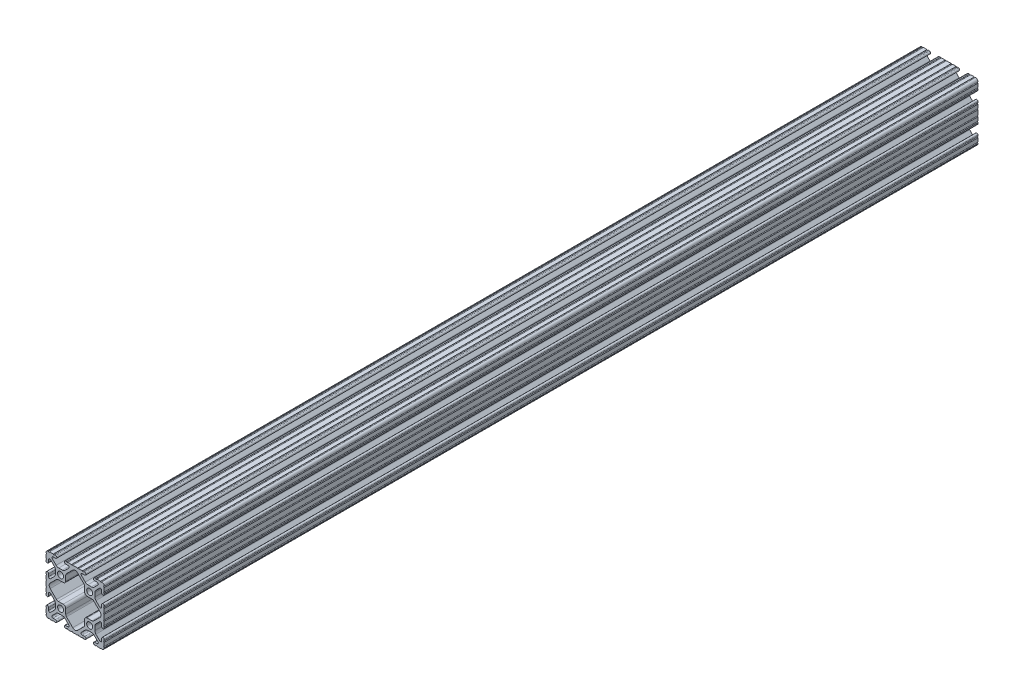
from build123d import *

# Parameters (mm, degrees)
SKETCH1_R      = 2.6035
EXTRUDE1_DEPTH = 381


with BuildPart() as part:
    # Sketch1 → Extrude1 (new, symmetric)
    with BuildSketch(Plane.XY):
        with BuildLine():
            Line((-2.1336, -25.4), (2.1336, -25.4))
            ThreePointArc((2.1336, -25.4), (2.6416, -24.892), (3.1496, -25.4))
            Line((3.1496, -25.4), (6.3754, -25.4))
            ThreePointArc((6.3754, -25.4), (6.8834, -24.892), (7.3914, -25.4))
            Line((7.3914, -25.4), (8.3439, -25.4))
            ThreePointArc((8.3439, -25.4), (9.4488, -24.2951), (8.3439, -23.1902))
            Line((8.3439, -23.1902), (6.225205544, -23.1902))
            ThreePointArc((6.225205544, -23.1902), (5.286543939, -22.563006367), (5.506785055, -21.45577951))
            Line((5.506785055, -21.45577951), (8.824128595, -18.13843597))
            ThreePointArc((8.824128595, -18.13843597), (9.854172728, -17.450182484), (11.069192626, -17.2085))
            Line((11.069192626, -17.2085), (14.330807374, -17.2085))
            ThreePointArc((14.330807374, -17.2085), (15.545827272, -17.450182484), (16.575871405, -18.13843597))
            Line((16.575871405, -18.13843597), (19.893214945, -21.45577951))
            ThreePointArc((19.893214945, -21.45577951), (20.113456061, -22.563006367), (19.174794456, -23.1902))
            Line((19.174794456, -23.1902), (17.0561, -23.1902))
            ThreePointArc((17.0561, -23.1902), (15.9512, -24.2951), (17.0561, -25.4))
            Line((17.0561, -25.4), (18.0086, -25.4))
            ThreePointArc((18.0086, -25.4), (18.5166, -24.892), (19.0246, -25.4))
            Line((19.0246, -25.4), (22.2504, -25.4))
            ThreePointArc((22.2504, -25.4), (22.7584, -24.892), (23.2664, -25.4))
            Line((23.2664, -25.4), (23.2918, -25.4))
            ThreePointArc((23.2918, -25.4), (24.782522516, -24.782522516), (25.4, -23.2918))
            Line((25.4, -23.2918), (25.4, -23.2664))
            ThreePointArc((25.4, -23.2664), (24.892, -22.7584), (25.4, -22.2504))
            Line((25.4, -22.2504), (25.4, -19.0246))
            ThreePointArc((25.4, -19.0246), (24.892, -18.5166), (25.4, -18.0086))
            Line((25.4, -18.0086), (25.4, -17.0561))
            ThreePointArc((25.4, -17.0561), (24.2951, -15.9512), (23.1902, -17.0561))
            Line((23.1902, -17.0561), (23.1902, -19.174794456))
            ThreePointArc((23.1902, -19.174794456), (22.563006367, -20.113456061), (21.45577951, -19.893214945))
            Line((21.45577951, -19.893214945), (18.13843597, -16.575871405))
            ThreePointArc((18.13843597, -16.575871405), (17.450182484, -15.545827272), (17.2085, -14.330807374))
            Line((17.2085, -14.330807374), (17.2085, -11.069192626))
            ThreePointArc((17.2085, -11.069192626), (17.450182484, -9.854172728), (18.13843597, -8.824128595))
            Line((18.13843597, -8.824128595), (21.45577951, -5.506785055))
            ThreePointArc((21.45577951, -5.506785055), (22.563006367, -5.286543939), (23.1902, -6.225205544))
            Line((23.1902, -6.225205544), (23.1902, -8.3439))
            ThreePointArc((23.1902, -8.3439), (24.2951, -9.4488), (25.4, -8.3439))
            Line((25.4, -8.3439), (25.4, -7.3914))
            ThreePointArc((25.4, -7.3914), (24.892, -6.8834), (25.4, -6.3754))
            Line((25.4, -6.3754), (25.4, -3.1496))
            ThreePointArc((25.4, -3.1496), (24.892, -2.6416), (25.4, -2.1336))
            Line((25.4, -2.1336), (25.4, 2.1336))
            ThreePointArc((25.4, 2.1336), (24.892, 2.6416), (25.4, 3.1496))
            Line((25.4, 3.1496), (25.4, 6.3754))
            ThreePointArc((25.4, 6.3754), (24.892, 6.8834), (25.4, 7.3914))
            Line((25.4, 7.3914), (25.4, 8.3439))
            ThreePointArc((25.4, 8.3439), (24.2951, 9.4488), (23.1902, 8.3439))
            Line((23.1902, 8.3439), (23.1902, 6.225205544))
            ThreePointArc((23.1902, 6.225205544), (22.563006367, 5.286543939), (21.45577951, 5.506785055))
            Line((21.45577951, 5.506785055), (18.13843597, 8.824128595))
            ThreePointArc((18.13843597, 8.824128595), (17.450182484, 9.854172728), (17.2085, 11.069192626))
            Line((17.2085, 11.069192626), (17.2085, 14.330807374))
            ThreePointArc((17.2085, 14.330807374), (17.450182484, 15.545827272), (18.13843597, 16.575871405))
            Line((18.13843597, 16.575871405), (21.45577951, 19.893214945))
            ThreePointArc((21.45577951, 19.893214945), (22.563006367, 20.113456061), (23.1902, 19.174794456))
            Line((23.1902, 19.174794456), (23.1902, 17.0561))
            ThreePointArc((23.1902, 17.0561), (24.2951, 15.9512), (25.4, 17.0561))
            Line((25.4, 17.0561), (25.4, 18.0086))
            ThreePointArc((25.4, 18.0086), (24.892, 18.5166), (25.4, 19.0246))
            Line((25.4, 19.0246), (25.4, 22.2504))
            ThreePointArc((25.4, 22.2504), (24.892, 22.7584), (25.4, 23.2664))
            Line((25.4, 23.2664), (25.4, 23.2918))
            ThreePointArc((25.4, 23.2918), (24.782522516, 24.782522516), (23.2918, 25.4))
            Line((23.2918, 25.4), (23.2664, 25.4))
            ThreePointArc((23.2664, 25.4), (22.7584, 24.892), (22.2504, 25.4))
            Line((22.2504, 25.4), (19.0246, 25.4))
            ThreePointArc((19.0246, 25.4), (18.5166, 24.892), (18.0086, 25.4))
            Line((18.0086, 25.4), (17.0561, 25.4))
            ThreePointArc((17.0561, 25.4), (15.9512, 24.2951), (17.0561, 23.1902))
            Line((17.0561, 23.1902), (19.174794456, 23.1902))
            ThreePointArc((19.174794456, 23.1902), (20.113456061, 22.563006367), (19.893214945, 21.45577951))
            Line((19.893214945, 21.45577951), (16.575871405, 18.13843597))
            ThreePointArc((16.575871405, 18.13843597), (15.545827272, 17.450182484), (14.330807374, 17.2085))
            Line((14.330807374, 17.2085), (11.069192626, 17.2085))
            ThreePointArc((11.069192626, 17.2085), (9.854172728, 17.450182484), (8.824128595, 18.13843597))
            Line((8.824128595, 18.13843597), (5.506785055, 21.45577951))
            ThreePointArc((5.506785055, 21.45577951), (5.286543939, 22.563006367), (6.225205544, 23.1902))
            Line((6.225205544, 23.1902), (8.3439, 23.1902))
            ThreePointArc((8.3439, 23.1902), (9.4488, 24.2951), (8.3439, 25.4))
            Line((8.3439, 25.4), (7.3914, 25.4))
            ThreePointArc((7.3914, 25.4), (6.8834, 24.892), (6.3754, 25.4))
            Line((6.3754, 25.4), (3.1496, 25.4))
            ThreePointArc((3.1496, 25.4), (2.6416, 24.892), (2.1336, 25.4))
            Line((2.1336, 25.4), (-2.1336, 25.4))
            ThreePointArc((-2.1336, 25.4), (-2.6416, 24.892), (-3.1496, 25.4))
            Line((-3.1496, 25.4), (-6.3754, 25.4))
            ThreePointArc((-6.3754, 25.4), (-6.8834, 24.892), (-7.3914, 25.4))
            Line((-7.3914, 25.4), (-8.3439, 25.4))
            ThreePointArc((-8.3439, 25.4), (-9.4488, 24.2951), (-8.3439, 23.1902))
            Line((-8.3439, 23.1902), (-6.225205544, 23.1902))
            ThreePointArc((-6.225205544, 23.1902), (-5.286543939, 22.563006367), (-5.506785055, 21.45577951))
            Line((-5.506785055, 21.45577951), (-8.824128595, 18.13843597))
            ThreePointArc((-8.824128595, 18.13843597), (-9.854172728, 17.450182484), (-11.069192626, 17.2085))
            Line((-11.069192626, 17.2085), (-14.330807374, 17.2085))
            ThreePointArc((-14.330807374, 17.2085), (-15.545827272, 17.450182484), (-16.575871405, 18.13843597))
            Line((-16.575871405, 18.13843597), (-19.893214945, 21.45577951))
            ThreePointArc((-19.893214945, 21.45577951), (-20.113456061, 22.563006367), (-19.174794456, 23.1902))
            Line((-19.174794456, 23.1902), (-17.0561, 23.1902))
            ThreePointArc((-17.0561, 23.1902), (-15.9512, 24.2951), (-17.0561, 25.4))
            Line((-17.0561, 25.4), (-18.0086, 25.4))
            ThreePointArc((-18.0086, 25.4), (-18.5166, 24.892), (-19.0246, 25.4))
            Line((-19.0246, 25.4), (-22.2504, 25.4))
            ThreePointArc((-22.2504, 25.4), (-22.7584, 24.892), (-23.2664, 25.4))
            Line((-23.2664, 25.4), (-23.2918, 25.4))
            ThreePointArc((-23.2918, 25.4), (-24.782522516, 24.782522516), (-25.4, 23.2918))
            Line((-25.4, 23.2918), (-25.4, 23.2664))
            ThreePointArc((-25.4, 23.2664), (-24.892, 22.7584), (-25.4, 22.2504))
            Line((-25.4, 22.2504), (-25.4, 19.0246))
            ThreePointArc((-25.4, 19.0246), (-24.892, 18.5166), (-25.4, 18.0086))
            Line((-25.4, 18.0086), (-25.4, 17.0561))
            ThreePointArc((-25.4, 17.0561), (-24.2951, 15.9512), (-23.1902, 17.0561))
            Line((-23.1902, 17.0561), (-23.1902, 19.174794456))
            ThreePointArc((-23.1902, 19.174794456), (-22.563006367, 20.113456061), (-21.45577951, 19.893214945))
            Line((-21.45577951, 19.893214945), (-18.13843597, 16.575871405))
            ThreePointArc((-18.13843597, 16.575871405), (-17.450182484, 15.545827272), (-17.2085, 14.330807374))
            Line((-17.2085, 14.330807374), (-17.2085, 11.069192626))
            ThreePointArc((-17.2085, 11.069192626), (-17.450182484, 9.854172728), (-18.13843597, 8.824128595))
            Line((-18.13843597, 8.824128595), (-21.45577951, 5.506785055))
            ThreePointArc((-21.45577951, 5.506785055), (-22.563006367, 5.286543939), (-23.1902, 6.225205544))
            Line((-23.1902, 6.225205544), (-23.1902, 8.3439))
            ThreePointArc((-23.1902, 8.3439), (-24.2951, 9.4488), (-25.4, 8.3439))
            Line((-25.4, 8.3439), (-25.4, 7.3914))
            ThreePointArc((-25.4, 7.3914), (-24.892, 6.8834), (-25.4, 6.3754))
            Line((-25.4, 6.3754), (-25.4, 3.1496))
            ThreePointArc((-25.4, 3.1496), (-24.892, 2.6416), (-25.4, 2.1336))
            Line((-25.4, 2.1336), (-25.4, -2.1336))
            ThreePointArc((-25.4, -2.1336), (-24.892, -2.6416), (-25.4, -3.1496))
            Line((-25.4, -3.1496), (-25.4, -6.3754))
            ThreePointArc((-25.4, -6.3754), (-24.892, -6.8834), (-25.4, -7.3914))
            Line((-25.4, -7.3914), (-25.4, -8.3439))
            ThreePointArc((-25.4, -8.3439), (-24.2951, -9.4488), (-23.1902, -8.3439))
            Line((-23.1902, -8.3439), (-23.1902, -6.225205544))
            ThreePointArc((-23.1902, -6.225205544), (-22.563006367, -5.286543939), (-21.45577951, -5.506785055))
            Line((-21.45577951, -5.506785055), (-18.13843597, -8.824128595))
            ThreePointArc((-18.13843597, -8.824128595), (-17.450182484, -9.854172728), (-17.2085, -11.069192626))
            Line((-17.2085, -11.069192626), (-17.2085, -14.330807374))
            ThreePointArc((-17.2085, -14.330807374), (-17.450182484, -15.545827272), (-18.13843597, -16.575871405))
            Line((-18.13843597, -16.575871405), (-21.45577951, -19.893214945))
            ThreePointArc((-21.45577951, -19.893214945), (-22.563006367, -20.113456061), (-23.1902, -19.174794456))
            Line((-23.1902, -19.174794456), (-23.1902, -17.0561))
            ThreePointArc((-23.1902, -17.0561), (-24.2951, -15.9512), (-25.4, -17.0561))
            Line((-25.4, -17.0561), (-25.4, -18.0086))
            ThreePointArc((-25.4, -18.0086), (-24.892, -18.5166), (-25.4, -19.0246))
            Line((-25.4, -19.0246), (-25.4, -22.2504))
            ThreePointArc((-25.4, -22.2504), (-24.892, -22.7584), (-25.4, -23.2664))
            Line((-25.4, -23.2664), (-25.4, -23.2918))
            ThreePointArc((-25.4, -23.2918), (-24.782522516, -24.782522516), (-23.2918, -25.4))
            Line((-23.2918, -25.4), (-23.2664, -25.4))
            ThreePointArc((-23.2664, -25.4), (-22.7584, -24.892), (-22.2504, -25.4))
            Line((-22.2504, -25.4), (-19.0246, -25.4))
            ThreePointArc((-19.0246, -25.4), (-18.5166, -24.892), (-18.0086, -25.4))
            Line((-18.0086, -25.4), (-17.0561, -25.4))
            ThreePointArc((-17.0561, -25.4), (-15.9512, -24.2951), (-17.0561, -23.1902))
            Line((-17.0561, -23.1902), (-19.174794456, -23.1902))
            ThreePointArc((-19.174794456, -23.1902), (-20.113456061, -22.563006367), (-19.893214945, -21.45577951))
            Line((-19.893214945, -21.45577951), (-16.575871405, -18.13843597))
            ThreePointArc((-16.575871405, -18.13843597), (-15.545827272, -17.450182484), (-14.330807374, -17.2085))
            Line((-14.330807374, -17.2085), (-11.069192626, -17.2085))
            ThreePointArc((-11.069192626, -17.2085), (-9.854172728, -17.450182484), (-8.824128595, -18.13843597))
            Line((-8.824128595, -18.13843597), (-5.506785055, -21.45577951))
            ThreePointArc((-5.506785055, -21.45577951), (-5.286543939, -22.563006367), (-6.225205544, -23.1902))
            Line((-6.225205544, -23.1902), (-8.3439, -23.1902))
            ThreePointArc((-8.3439, -23.1902), (-9.4488, -24.2951), (-8.3439, -25.4))
            Line((-8.3439, -25.4), (-7.3914, -25.4))
            ThreePointArc((-7.3914, -25.4), (-6.8834, -24.892), (-6.3754, -25.4))
            Line((-6.3754, -25.4), (-3.1496, -25.4))
            ThreePointArc((-3.1496, -25.4), (-2.6416, -24.892), (-2.1336, -25.4))
        make_face()
        with Locations((12.7, 12.7)):
            Circle(SKETCH1_R, mode=Mode.SUBTRACT)
        with Locations((12.7, -12.7)):
            Circle(SKETCH1_R, mode=Mode.SUBTRACT)
        with Locations((-12.7, 12.7)):
            Circle(SKETCH1_R, mode=Mode.SUBTRACT)
        with Locations((-12.7, -12.7)):
            Circle(SKETCH1_R, mode=Mode.SUBTRACT)
        with BuildLine():
            Line((-10.4013, 8.1915), (-14.730606305, 8.1915))
            ThreePointArc((-14.730606305, 8.1915), (-15.576260154, 8.023288991), (-16.29317087, 7.544264565))
            Line((-16.29317087, 7.544264565), (-21.771976527, 2.065458908))
            ThreePointArc((-21.771976527, 2.065458908), (-22.627517619, 0), (-21.771976527, -2.065458908))
            Line((-21.771976527, -2.065458908), (-16.29317087, -7.544264565))
            ThreePointArc((-16.29317087, -7.544264565), (-15.576260154, -8.023288991), (-14.730606305, -8.1915))
            Line((-14.730606305, -8.1915), (-10.4013, -8.1915))
            ThreePointArc((-10.4013, -8.1915), (-8.838735435, -8.838735435), (-8.1915, -10.4013))
            Line((-8.1915, -10.4013), (-8.1915, -14.730606305))
            ThreePointArc((-8.1915, -14.730606305), (-8.023288991, -15.576260154), (-7.544264565, -16.29317087))
            Line((-7.544264565, -16.29317087), (-2.065458908, -21.771976527))
            ThreePointArc((-2.065458908, -21.771976527), (0, -22.627517619), (2.065458908, -21.771976527))
            Line((2.065458908, -21.771976527), (7.544264565, -16.29317087))
            ThreePointArc((7.544264565, -16.29317087), (8.023288991, -15.576260154), (8.1915, -14.730606305))
            Line((8.1915, -14.730606305), (8.1915, -10.4013))
            ThreePointArc((8.1915, -10.4013), (8.838735435, -8.838735435), (10.4013, -8.1915))
            Line((10.4013, -8.1915), (14.730606305, -8.1915))
            ThreePointArc((14.730606305, -8.1915), (15.576260154, -8.023288991), (16.29317087, -7.544264565))
            Line((16.29317087, -7.544264565), (21.771976527, -2.065458908))
            ThreePointArc((21.771976527, -2.065458908), (22.627517619, 0), (21.771976527, 2.065458908))
            Line((21.771976527, 2.065458908), (16.29317087, 7.544264565))
            ThreePointArc((16.29317087, 7.544264565), (15.576260154, 8.023288991), (14.730606305, 8.1915))
            Line((14.730606305, 8.1915), (10.4013, 8.1915))
            ThreePointArc((10.4013, 8.1915), (8.838735435, 8.838735435), (8.1915, 10.4013))
            Line((8.1915, 10.4013), (8.1915, 14.730606305))
            ThreePointArc((8.1915, 14.730606305), (8.023288991, 15.576260154), (7.544264565, 16.29317087))
            Line((7.544264565, 16.29317087), (2.065458908, 21.771976527))
            ThreePointArc((2.065458908, 21.771976527), (0, 22.627517619), (-2.065458908, 21.771976527))
            Line((-2.065458908, 21.771976527), (-7.544264565, 16.29317087))
            ThreePointArc((-7.544264565, 16.29317087), (-8.023288991, 15.576260154), (-8.1915, 14.730606305))
            Line((-8.1915, 14.730606305), (-8.1915, 10.4013))
            ThreePointArc((-8.1915, 10.4013), (-8.838735435, 8.838735435), (-10.4013, 8.1915))
        make_face(mode=Mode.SUBTRACT)
    extrude(amount=EXTRUDE1_DEPTH, both=True)


solid = part.part
